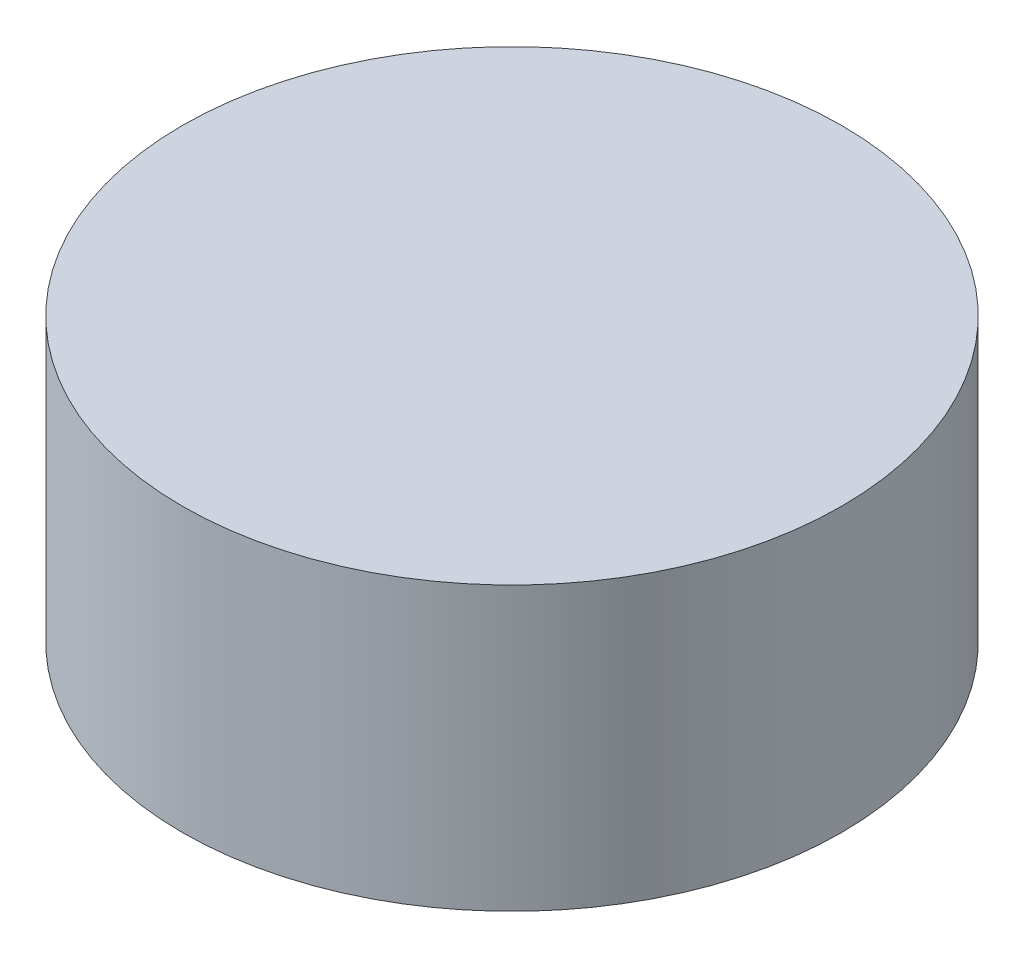
from build123d import *

# Parameters (mm, degrees)
SKETCH1_R           = 17.5
BOSS_EXTRUDE1_DEPTH = 7.5


with BuildPart() as part:
    # Sketch1 → Boss-Extrude1 (new, symmetric)
    with BuildSketch(Plane(origin=(0, 0, 0), x_dir=(1, 0, 0), z_dir=(0, 1, 0))):
        with Locations(Location((0, 0, 0), (0, 0, 270))):
            Circle(SKETCH1_R)
    extrude(amount=BOSS_EXTRUDE1_DEPTH, both=True)


solid = part.part
